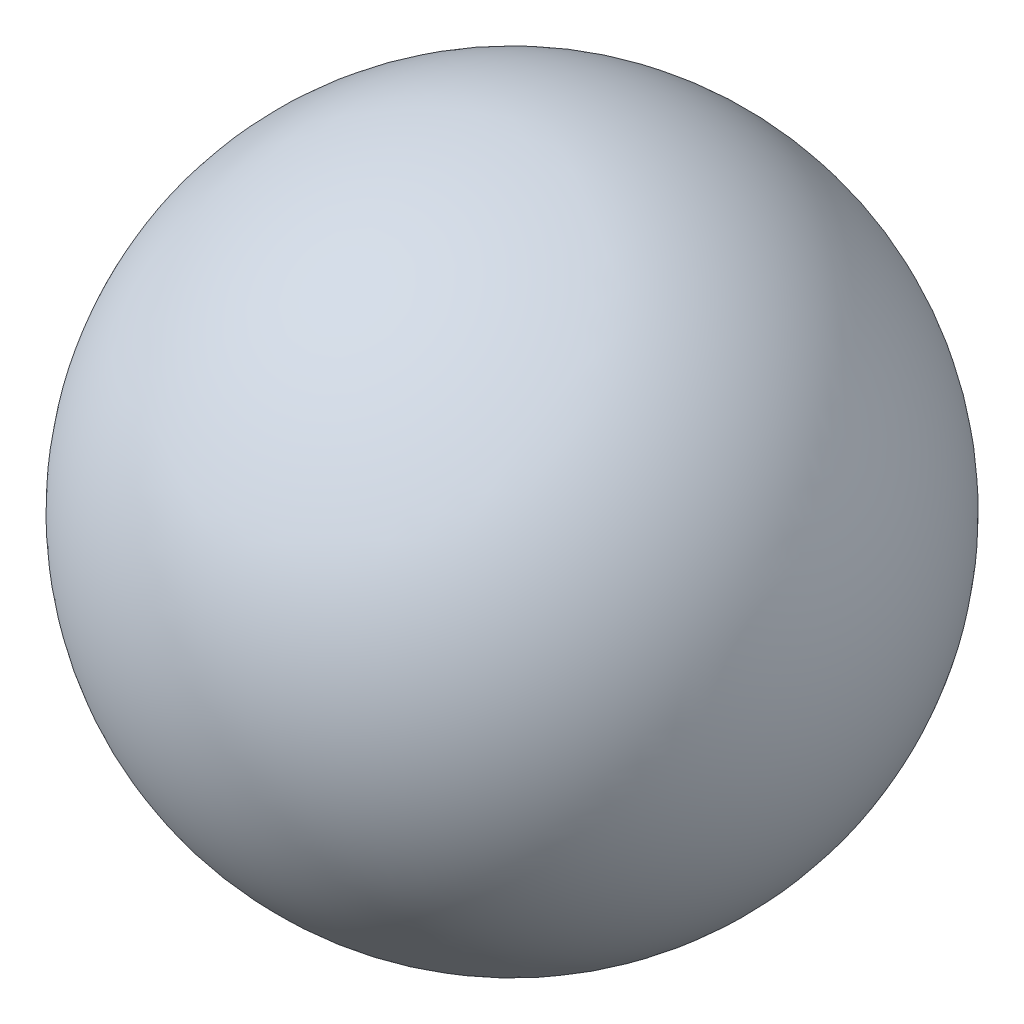
from build123d import *


with BuildPart() as part:
    # Sketch1 → Revolve1 (revolve)
    with BuildSketch(Plane.XY):
        with BuildLine():
            Line((-12, 0), (12, 0))
            ThreePointArc((12, 0), (0, -12), (-12, 0))
        make_face()
    revolve(axis=Axis((0, 0, 0), (-1, 0, 0)))


solid = part.part
